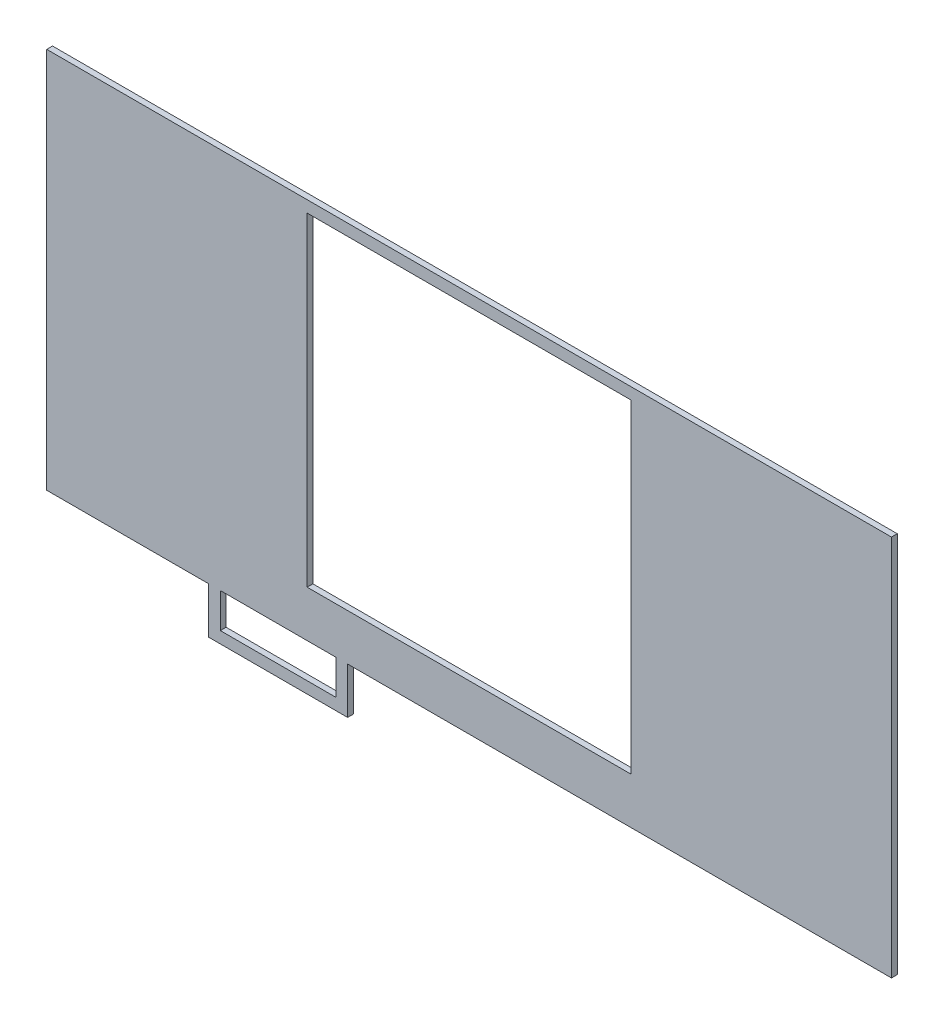
from build123d import *

# Parameters (mm, degrees)
CROQUIS2_W              = 730
CROQUIS2_H              = 330
SALIENTE_EXTRUIR2_DEPTH = 5
CROQUIS4_W              = 280
CROQUIS4_H              = 280
CORTAR_EXTRUIR1_DEPTH   = 5
SALIENTE_EXTRUIR3_DEPTH = 5


with BuildPart() as part:
    # Croquis2 → Saliente-Extruir2 (new body)
    with BuildSketch(Plane.XY):
        Rectangle(CROQUIS2_W, CROQUIS2_H)
    extrude(amount=SALIENTE_EXTRUIR2_DEPTH)

    # Croquis4 → Cortar-Extruir1 (cut)
    with BuildSketch(Plane.XY.offset(5)):
        with Locations((0, 15)):
            Rectangle(CROQUIS4_W, CROQUIS4_H)
    extrude(amount=-CORTAR_EXTRUIR1_DEPTH, mode=Mode.SUBTRACT)

    # Croquis5 → Saliente-Extruir3 (add)
    with BuildSketch(Plane.XY.offset(5)):
        Polygon((-215, -165), (-225, -165), (-225, -205), (-105, -205), (-105, -165), (-115, -165), (-115, -195), (-215, -195), align=None)
    extrude(amount=-SALIENTE_EXTRUIR3_DEPTH)


solid = part.part
